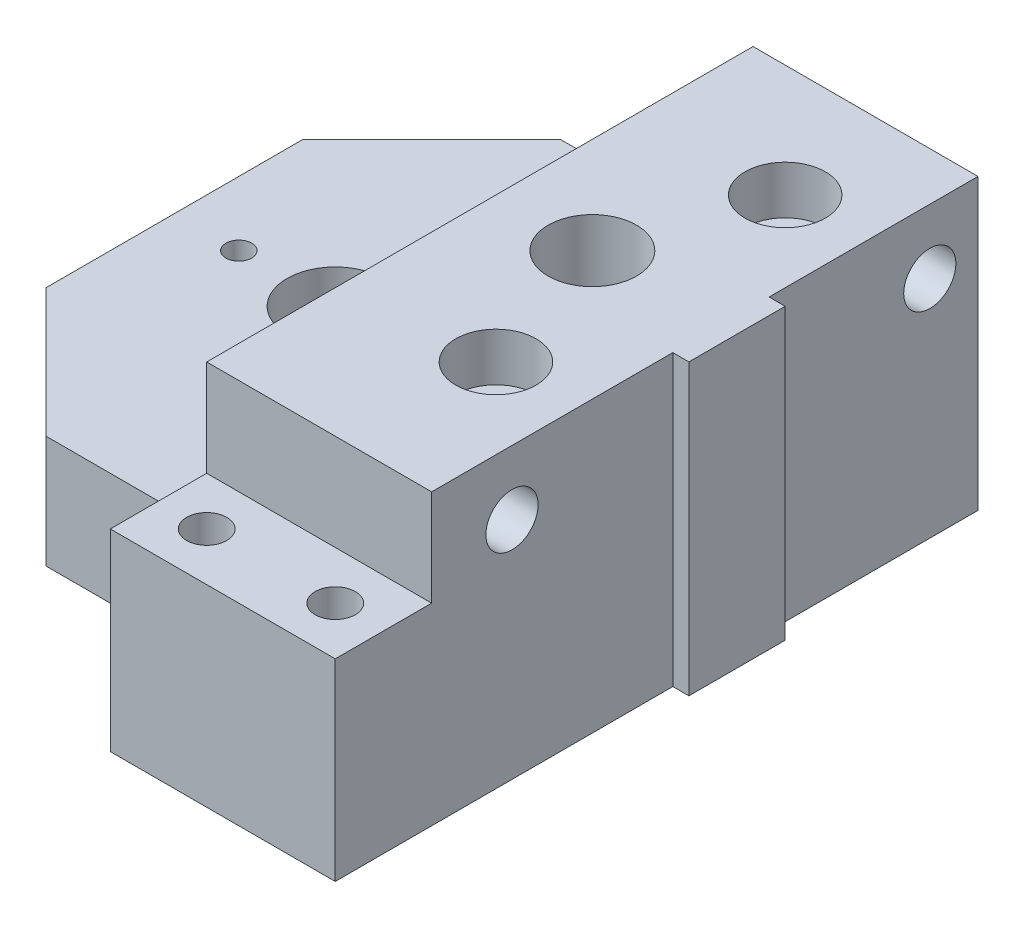
from build123d import *

# Parameters (mm, degrees)
BOSS_EXTRUDE1_DEPTH = 11.1125
BOSS_EXTRUDE2_START = -11.1125
SKETCH2_W           = 44.45
SKETCH2_H           = 127
BOSS_EXTRUDE2_DEPTH = 38.1
BOSS_EXTRUDE3_START = 26.9875
SKETCH3_W           = 44.45
SKETCH3_H           = 107.95
BOSS_EXTRUDE3_DEPTH = 19.05
BOSS_EXTRUDE4_START = -11.1125
SKETCH4_W           = 3.175
SKETCH4_H           = 19.0246
BOSS_EXTRUDE4_DEPTH = 57.15
CUT_EXTRUDE2_START  = 11.1125
SKETCH5_R           = 9.525
CUT_EXTRUDE2_DEPTH  = 131.386478852
CUT_EXTRUDE4_START  = 11.1125
SKETCH6_R           = 2.5527
CUT_EXTRUDE4_DEPTH  = 12.7
CUT_EXTRUDE6_START  = 11.1125
SKETCH7_R           = 2.5527
CUT_EXTRUDE6_DEPTH  = 12.7
CUT_EXTRUDE8_START  = 46.0375
SKETCH8_R           = 8.73125
CUT_EXTRUDE8_DEPTH  = 31.75
CUT_EXTRUDE10_START = 26.9875
SKETCH9_R           = 3.96875
CUT_EXTRUDE10_DEPTH = 19.05
CUT_EXTRUDE12_START = 46.0375
SKETCH10_R          = 5.1562
CUT_EXTRUDE12_DEPTH = 166.311478852
CUT_EXTRUDE14_START = 46.0375
SKETCH11_R          = 7.9375
CUT_EXTRUDE14_DEPTH = 9.525
CUT_EXTRUDE16_START = 31.75
SKETCH12_R          = 5.1562
CUT_EXTRUDE16_DEPTH = 88.523978852
CUT_EXTRUDE18_START = 31.75
SKETCH13_R          = 7.9375
CUT_EXTRUDE18_DEPTH = 9.525


with BuildPart() as part:
    # Sketch1 → Boss-Extrude1 (new, symmetric)
    with BuildSketch(Plane(origin=(0, 0, 0), x_dir=(1, 0, 0), z_dir=(0, 1, 0))):
        Polygon((-31.75, -25.4), (-6.35, -50.8), (31.75, -50.8), (31.75, 50.8), (-6.35, 50.8), (-31.75, 25.4), align=None)
    extrude(amount=BOSS_EXTRUDE1_DEPTH, both=True)

    # Sketch2 → Boss-Extrude2 (add)
    with BuildSketch(Plane(origin=(0, 0, 0), x_dir=(1, 0, 0), z_dir=(0, 1, 0)).offset(BOSS_EXTRUDE2_START)):
        with Locations((53.975, -12.7)):
            Rectangle(SKETCH2_W, SKETCH2_H)
    extrude(amount=BOSS_EXTRUDE2_DEPTH)

    # Sketch3 → Boss-Extrude3 (add)
    with BuildSketch(Plane(origin=(0, 0, 0), x_dir=(1, 0, 0), z_dir=(0, 1, 0)).offset(BOSS_EXTRUDE3_START)):
        with Locations((53.975, -3.175)):
            Rectangle(SKETCH3_W, SKETCH3_H)
    extrude(amount=BOSS_EXTRUDE3_DEPTH)

    # Sketch4 → Boss-Extrude4 (add)
    with BuildSketch(Plane(origin=(0, 0, 0), x_dir=(1, 0, 0), z_dir=(0, 1, 0)).offset(BOSS_EXTRUDE4_START)):
        with Locations((77.7875, 0.0127)):
            Rectangle(SKETCH4_W, SKETCH4_H)
    extrude(amount=BOSS_EXTRUDE4_DEPTH)

    # Sketch5 → Cut-Extrude2 (cut, through all)
    with BuildSketch(Plane(origin=(0, 0, 0), x_dir=(1, 0, 0), z_dir=(0, 1, 0)).offset(CUT_EXTRUDE2_START)):
        with Locations(Location((0, 0, 0), (0, 0, 270))):
            Circle(SKETCH5_R)
    extrude(amount=-CUT_EXTRUDE2_DEPTH, mode=Mode.SUBTRACT)

    # Sketch6 → Cut-Extrude4 (cut)
    with BuildSketch(Plane(origin=(0, 0, 0), x_dir=(1, 0, 0), z_dir=(0, 1, 0)).offset(CUT_EXTRUDE4_START)):
        with Locations(Location((-19.05, 0, 0), (0, 0, 270))):
            Circle(SKETCH6_R)
        with Locations(Location((9.525, -16.51, 0), (0, 0, 270))):
            Circle(SKETCH6_R)
    extrude(amount=-CUT_EXTRUDE4_DEPTH, mode=Mode.SUBTRACT)

    # Sketch7 → Cut-Extrude6 (cut)
    with BuildSketch(Plane(origin=(0, 0, 0), x_dir=(1, 0, 0), z_dir=(0, 1, 0)).offset(CUT_EXTRUDE6_START)):
        with Locations(Location((9.525, 16.51, 0), (0, 0, 270))):
            Circle(SKETCH7_R)
    extrude(amount=-CUT_EXTRUDE6_DEPTH, mode=Mode.SUBTRACT)

    # Sketch8 → Cut-Extrude8 (cut)
    with BuildSketch(Plane(origin=(0, 0, 0), x_dir=(1, 0, 0), z_dir=(0, 1, 0)).offset(CUT_EXTRUDE8_START)):
        with Locations(Location((50.8, 0, 0), (0, 0, 270))):
            Circle(SKETCH8_R)
    extrude(amount=-CUT_EXTRUDE8_DEPTH, mode=Mode.SUBTRACT)

    # Sketch9 → Cut-Extrude10 (cut)
    with BuildSketch(Plane(origin=(0, 0, 0), x_dir=(1, 0, 0), z_dir=(0, 1, 0)).offset(CUT_EXTRUDE10_START)):
        with Locations(Location((41.275, -66.675, 0), (0, 0, 270))):
            Circle(SKETCH9_R)
        with Locations(Location((66.675, -66.675, 0), (0, 0, 270))):
            Circle(SKETCH9_R)
    extrude(amount=-CUT_EXTRUDE10_DEPTH, mode=Mode.SUBTRACT)

    # Sketch10 → Cut-Extrude12 (cut, through all)
    with BuildSketch(Plane(origin=(0, 0, 0), x_dir=(1, 0, 0), z_dir=(0, 1, 0)).offset(CUT_EXTRUDE12_START)):
        with Locations(Location((60.325, -28.575, 0), (0, 0, 270))):
            Circle(SKETCH10_R)
        with Locations(Location((60.325, 28.575, 0), (0, 0, 270))):
            Circle(SKETCH10_R)
    extrude(amount=-CUT_EXTRUDE12_DEPTH, mode=Mode.SUBTRACT)

    # Sketch11 → Cut-Extrude14 (cut)
    with BuildSketch(Plane(origin=(0, 0, 0), x_dir=(1, 0, 0), z_dir=(0, 1, 0)).offset(CUT_EXTRUDE14_START)):
        with Locations(Location((60.325, -28.575, 0), (0, 0, 270))):
            Circle(SKETCH11_R)
        with Locations(Location((60.325, 28.575, 0), (0, 0, 270))):
            Circle(SKETCH11_R)
    extrude(amount=-CUT_EXTRUDE14_DEPTH, mode=Mode.SUBTRACT)

    # Sketch12 → Cut-Extrude16 (cut, through all)
    with BuildSketch(Plane(origin=(0, 0, 0), x_dir=(0, 0, -1), z_dir=(1, 0, 0)).offset(CUT_EXTRUDE16_START)):
        with Locations(Location((-41.275, 33.3375, 0), (0, 0, 180))):
            Circle(SKETCH12_R)
        with Locations(Location((41.275, 33.3375, 0), (0, 0, 180))):
            Circle(SKETCH12_R)
    extrude(amount=CUT_EXTRUDE16_DEPTH, mode=Mode.SUBTRACT)

    # Sketch13 → Cut-Extrude18 (cut)
    with BuildSketch(Plane(origin=(0, 0, 0), x_dir=(0, 0, -1), z_dir=(1, 0, 0)).offset(CUT_EXTRUDE18_START)):
        with Locations((-41.275, 33.3375)):
            Circle(SKETCH13_R)
        with Locations((41.275, 33.3375)):
            Circle(SKETCH13_R)
    extrude(amount=CUT_EXTRUDE18_DEPTH, mode=Mode.SUBTRACT)


solid = part.part
